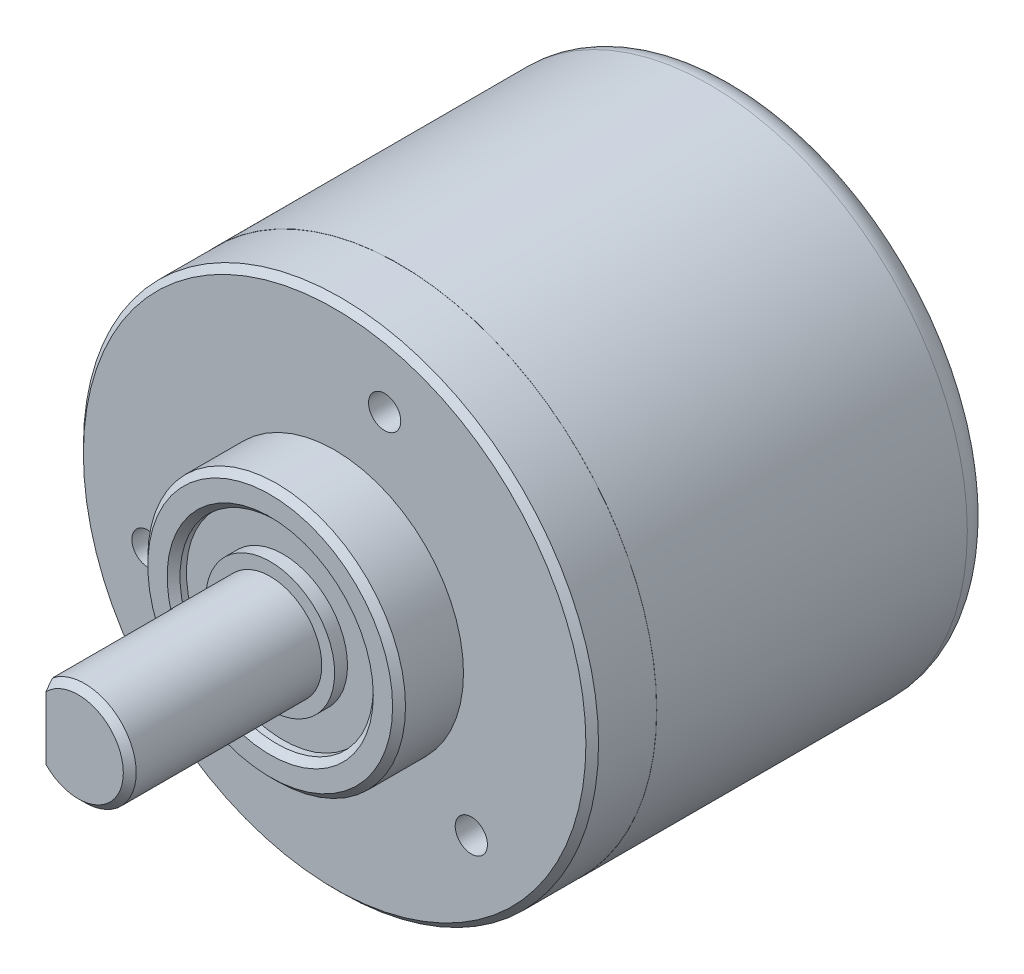
from build123d import *

# Parameters (mm, degrees)
FILLET3_R                      = 2
CUT_EXTRUDE11_START            = -10
CUT_EXTRUDE11_DEPTH            = 10
CHAMFER6_SIZE                  = 0.5
M3X0_5_TAPPED_HOLE1_AT_2_COUNT = 2
M3X0_5_TAPPED_HOLE1_AT_2_PITCH = 11.136209045
CIRPATTERN4_COUNT              = 3
SKETCH43_R                     = 1.25
EXTRUDE13_DEPTH                = 15
CUT_EXTRUDE13_START            = -5
SKETCH44_R                     = 20
SKETCH44_R_2                   = 19.99
CUT_EXTRUDE13_DEPTH            = 5


with BuildPart() as part:
    # Sketch37 → Revolve3 (revolve)
    with BuildSketch(Plane(origin=(0, 0, 0), x_dir=(0, 0, -1), z_dir=(1, 0, 0)), mode=Mode.PRIVATE) as revolve3_sk:
        Polygon((0, 0), (0, -4), (14.9, -4), (14.9, -5), (15.9, -5), (15.9, -7.5), (14.9, -7.5), (14.9, -10), (19.9, -10), (19.9, -20), (51, -20), (51, 0), align=None)
    revolve(revolve3_sk.sketch.rotate(Axis((0, 0, 0), (0, 0, -1)), 270), axis=Axis((0, 0, 0), (0, 0, -1)))

    # Fillet3
    fillet3_edges = [part.edges().sort_by_distance(p)[0] for p in [
        (-20, 0, -51),
    ]]
    fillet(fillet3_edges, radius=FILLET3_R)

    # Sketch38 → Cut-Extrude11 (cut)
    with BuildSketch(Plane.XY.offset(CUT_EXTRUDE11_START)):
        with BuildLine():
            Line((-2.5, 3.122498999), (-2.5, -3.122498999))
            ThreePointArc((-2.5, -3.122498999), (-4, 0), (-2.5, 3.122498999))
        make_face()
    extrude(amount=CUT_EXTRUDE11_DEPTH, mode=Mode.SUBTRACT)

    # Chamfer6
    chamfer6_edges = [part.edges().sort_by_distance(p)[0] for p in [
        (-10, 0, -14.9),
        (-7.5, 0, -14.9),
        (1.732050808, 3.605551275, 0),
        (-20, 0, -19.9),
    ]]
    chamfer(chamfer6_edges, length=CHAMFER6_SIZE)

    # Sketch40 → M3x0.5 Tapped Hole1 (revolve, cut)
    with BuildSketch(Plane(origin=(0, -14, -19.9), x_dir=(0, -1, 0), z_dir=(1, 0, 0))):
        Polygon((0, 0), (0, 9.251075774), (1.25, 8.5), (1.25, 0), align=None)
    m3x0_5_tapped_hole1 = revolve(axis=Axis((0, -14, -13.55), (0, 0, -1)), mode=Mode.SUBTRACT)

    # M3x0.5 Tapped Hole1 at 2: M3x0.5 Tapped Hole1 ×2
    with Locations(*[Vector(0.9524427634762035, 0.30471754511647786, 0) * (i * M3X0_5_TAPPED_HOLE1_AT_2_PITCH) for i in range(1, M3X0_5_TAPPED_HOLE1_AT_2_COUNT)]):
        add(m3x0_5_tapped_hole1, mode=Mode.SUBTRACT)

    # CirPattern4: M3x0.5 Tapped Hole1 ×3 about axis
    cirpattern4_axis = Axis((0, 0, 0), (0, 0, 1))
    for i in range(1, CIRPATTERN4_COUNT):
        add(m3x0_5_tapped_hole1.rotate(cirpattern4_axis, i * 360 / CIRPATTERN4_COUNT), mode=Mode.SUBTRACT)

    # CirPattern4 copy 1 sketch → CirPattern4 copy 1 (revolve, cut)
    with BuildSketch(Plane(origin=(3.882285677, 14.488887394, -19.9), x_dir=(0.8660254037844387, 0.4999999999999998, 0), z_dir=(-0.4999999999999998, 0.8660254037844387, 0))):
        Polygon((0, 0), (0, 9.251075774), (1.25, 8.5), (1.25, 0), align=None)
    revolve(axis=Axis((3.882285677, 14.488887394, -13.55), (0, 0, -1)), mode=Mode.SUBTRACT)

    # CirPattern4 copy 2 sketch → CirPattern4 copy 2 (revolve, cut)
    with BuildSketch(Plane(origin=(-14.488887394, -3.882285677, -19.9), x_dir=(-0.8660254037844384, 0.5000000000000004, 0), z_dir=(-0.5000000000000004, -0.8660254037844384, 0))):
        Polygon((0, 0), (0, 9.251075774), (1.25, 8.5), (1.25, 0), align=None)
    revolve(axis=Axis((-14.488887394, -3.882285677, -13.55), (0, 0, -1)), mode=Mode.SUBTRACT)

    # Sketch43 → Extrude13 (add)
    with BuildSketch(Plane.XY.offset(-19.9)):
        with Locations((0, -14)):
            Circle(SKETCH43_R)
        with Locations((-12.124355653, 7)):
            Circle(SKETCH43_R)
        with Locations((12.124355653, 7)):
            Circle(SKETCH43_R)
    extrude(amount=-EXTRUDE13_DEPTH)

    # Sketch44 → Cut-Extrude13 (cut)
    with BuildSketch(Plane.XY.offset(-19.9).offset(CUT_EXTRUDE13_START)):
        Circle(SKETCH44_R)
        Circle(SKETCH44_R_2, mode=Mode.SUBTRACT)
    extrude(amount=CUT_EXTRUDE13_DEPTH, mode=Mode.SUBTRACT)


solid = part.part
